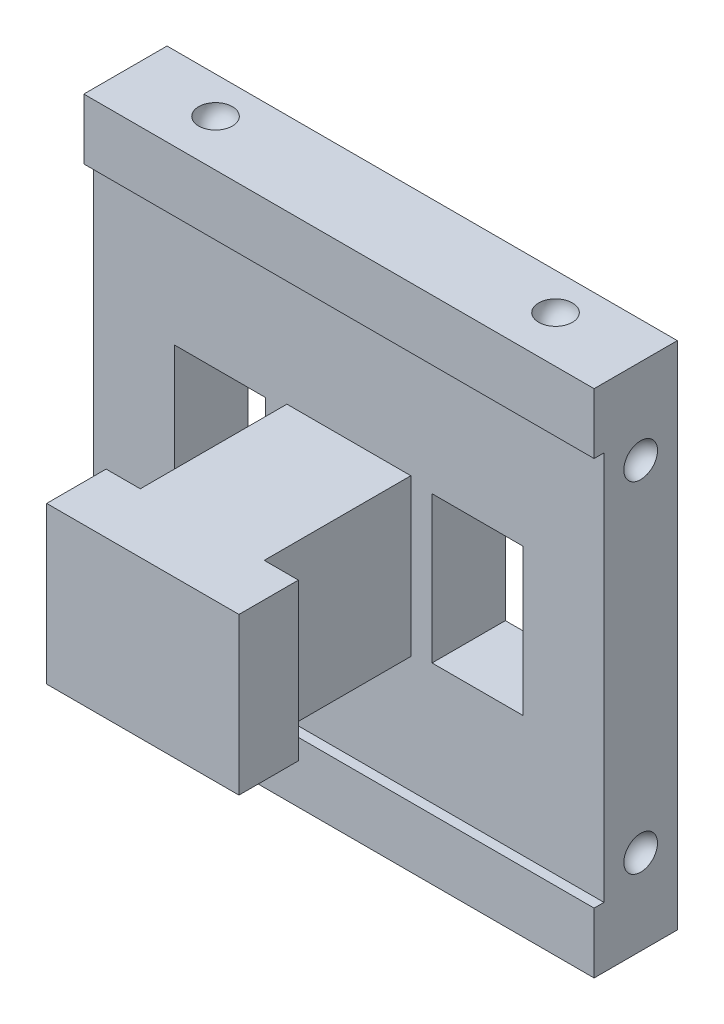
from build123d import *

# Parameters (mm, degrees)
EXTRUDE_1_DEPTH     = 3.7
CUT_EXTRUDE_1_REACH = 37.162
SKETCH_2_W          = 4.6
SKETCH_2_H          = 7.4
SKETCH_3_W          = 25.755
SKETCH_3_H          = 2
EXTRUDE_2_DEPTH     = 1
SKETCH_4_W          = 6.255
SKETCH_4_H          = 7.9
SKETCH_4_W_2        = 2.95
EXTRUDE_3_DEPTH     = 10.4
SKETCH_5_W          = 1.725
SKETCH_5_H          = 7.9
EXTRUDE_4_DEPTH     = 3
CUT_EXTRUDE_START   = -7.9
SKETCH_9_W          = 2.95
SKETCH_9_H          = 9.4
CUT_EXTRUDE_4_DEPTH = 7.9
FILLET_2_R          = 0.4
CUT_EXTRUDE_5_DEPTH = 7.9
CUT_EXTRUDE_START_2 = -25.755
SKETCH_12_W         = 1
SKETCH_12_H         = 2
CUT_EXTRUDE_6_DEPTH = 25.755
EXTRUDE_START       = -3.7
SKETCH_13_W         = 25.755
SKETCH_13_H         = 1.055
EXTRUDE_6_DEPTH     = 3.7
CUT_REVOLVE_1_ANGLE = 180
SKETCH_16_W         = 25.755
SKETCH_16_H         = 3.055
EXTRUDE_7_DEPTH     = 0.5


with BuildPart() as part:
    # ｽｹｯﾁ1 → ﾎﾞｽ - 押し出し1 (new body)
    with BuildSketch(Plane.XY):
        Polygon((0, 0), (12.75, 0), (25.755, 0), (25.755, 23.65), (12.75, 23.65), (0, 23.65), align=None)
    extrude(amount=EXTRUDE_1_DEPTH)

    # ｽｹｯﾁ2 → ｶｯﾄ - 押し出し1 (cut, up to next)
    with BuildSketch(Plane.XY.offset(3.7), mode=Mode.PRIVATE) as cut_extrude_1_sk1:
        with Locations((6.38, 11.825)):
            Rectangle(SKETCH_2_W, SKETCH_2_H)
    cut_extrude_1_tool1 = extrude(cut_extrude_1_sk1.sketch, amount=-CUT_EXTRUDE_1_REACH, mode=Mode.PRIVATE) & part.part
    # ｽｹｯﾁ2 → ｶｯﾄ - 押し出し1 (cut, up to next)
    with BuildSketch(Plane.XY.offset(3.7), mode=Mode.PRIVATE) as cut_extrude_1_sk2:
        with Locations((19.375, 11.825)):
            Rectangle(SKETCH_2_W, SKETCH_2_H)
    cut_extrude_1_tool2 = extrude(cut_extrude_1_sk2.sketch, amount=-CUT_EXTRUDE_1_REACH, mode=Mode.PRIVATE) & part.part
    add(cut_extrude_1_tool1.solids().sort_by_distance((6.38, 11.825, 3.7))[0], mode=Mode.SUBTRACT)
    add(cut_extrude_1_tool2.solids().sort_by_distance((19.375, 11.825, 3.7))[0], mode=Mode.SUBTRACT)

    # ｽｹｯﾁ3 → ﾎﾞｽ - 押し出し2 (add)
    with BuildSketch(Plane.XY.offset(3.7)):
        with Locations((12.8775, 22.65)):
            Rectangle(SKETCH_3_W, SKETCH_3_H)
        with Locations((12.8775, 1)):
            Rectangle(SKETCH_3_W, SKETCH_3_H)
    extrude(amount=EXTRUDE_2_DEPTH)

    # ｽｹｯﾁ4 → ﾎﾞｽ - 押し出し3 (add)
    with BuildSketch(Plane.XY.offset(3.7)):
        with Locations((12.8775, 11.825)):
            Rectangle(SKETCH_4_W, SKETCH_4_H)
        with Locations((1.475, 11.825)):
            Rectangle(SKETCH_4_W_2, SKETCH_4_H)
        with Locations((24.28, 11.825)):
            Rectangle(SKETCH_4_W_2, SKETCH_4_H)
    extrude(amount=EXTRUDE_3_DEPTH)

    # ｽｹｯﾁ5 → ﾎﾞｽ - 押し出し4 (add)
    with BuildSketch(Plane.XY.offset(14.1)):
        with Locations((16.8675, 11.825)):
            Rectangle(SKETCH_5_W, SKETCH_5_H)
        with Locations((8.8875, 11.825)):
            Rectangle(SKETCH_5_W, SKETCH_5_H)
    extrude(amount=-EXTRUDE_4_DEPTH)

    # ｽｹｯﾁ9 → ｶｯﾄ - 押し出し4 (cut)
    with BuildSketch(Plane.XZ.offset(-7.875).offset(CUT_EXTRUDE_START)):
        with Locations((1.475, 9.4)):
            Rectangle(SKETCH_9_W, SKETCH_9_H)
        with Locations((24.28, 9.4)):
            Rectangle(SKETCH_9_W, SKETCH_9_H)
    extrude(amount=CUT_EXTRUDE_4_DEPTH, mode=Mode.SUBTRACT)

    # ﾌｨﾚｯﾄ2
    fillet_2_edges = [part.edges().sort_by_distance(p)[0] for p in [
        (2.95, 11.825, 4.7),
        (22.805, 11.825, 4.7),
    ]]
    fillet(fillet_2_edges, radius=FILLET_2_R)

    # ｽｹｯﾁ11 → ｶｯﾄ - 押し出し5 (cut)
    with BuildSketch(Plane.XZ.offset(-7.875).offset(CUT_EXTRUDE_START)):
        with BuildLine():
            Line((2.95, 3.7), (2.95, 4.3))
            ThreePointArc((2.95, 4.3), (2.832842712, 4.582842712), (2.55, 4.7))
            Line((2.55, 4.7), (0, 4.7))
            Line((0, 4.7), (0, 3.7))
            Line((0, 3.7), (2.95, 3.7))
        make_face()
        with BuildLine():
            Line((25.755, 4.7), (23.205, 4.7))
            ThreePointArc((23.205, 4.7), (22.922157288, 4.582842712), (22.805, 4.3))
            Line((22.805, 4.3), (22.805, 3.7))
            Line((22.805, 3.7), (25.755, 3.7))
            Line((25.755, 3.7), (25.755, 4.7))
        make_face()
    extrude(amount=CUT_EXTRUDE_5_DEPTH, mode=Mode.SUBTRACT)

    # ｽｹｯﾁ12 → ｶｯﾄ - 押し出し6 (cut)
    with BuildSketch(Plane.ZY.offset(CUT_EXTRUDE_START_2)):
        with Locations((4.2, 22.65)):
            Rectangle(SKETCH_12_W, SKETCH_12_H)
        with Locations((4.2, 1)):
            Rectangle(SKETCH_12_W, SKETCH_12_H)
    extrude(amount=CUT_EXTRUDE_6_DEPTH, mode=Mode.SUBTRACT)

    # ｽｹｯﾁ13 → ﾎﾞｽ - 押し出し6 (add)
    with BuildSketch(Plane(origin=(0, 0, 0), x_dir=(-1, 0, 0), z_dir=(0, 0, -1)).offset(EXTRUDE_START)):
        with Locations((-12.8775, 24.1775)):
            Rectangle(SKETCH_13_W, SKETCH_13_H)
        with Locations((-12.8775, -0.5275)):
            Rectangle(SKETCH_13_W, SKETCH_13_H)
    extrude(amount=EXTRUDE_6_DEPTH)

    # ｽｹｯﾁ14 → ｶｯﾄ - 回転1 (revolve, cut)
    with BuildSketch(Plane(origin=(25.755, 0, 0), x_dir=(0, 0, -1), z_dir=(1, 0, 0))):
        with BuildLine():
            Line((-1.85, 21.255), (-1.85, 19.555))
            ThreePointArc((-1.85, 19.555), (-2.7, 20.405), (-1.85, 21.255))
        make_face()
        with BuildLine():
            Line((-1.85, 2.395), (-1.85, 4.095))
            ThreePointArc((-1.85, 4.095), (-2.7, 3.245), (-1.85, 2.395))
        make_face()
    cut_revolve_1 = revolve(axis=Axis((25.755, 21.255, 1.85), (0, -1, 0)), revolution_arc=CUT_REVOLVE_1_ANGLE, mode=Mode.SUBTRACT)

    # ﾐﾗｰ1: ｶｯﾄ - 回転1 across plane
    add(cut_revolve_1.mirror(Plane(origin=(12.8775, 0, 0), x_dir=(0, 0, 1), z_dir=(1, 0, 0))), mode=Mode.SUBTRACT)

    # ｽｹｯﾁ15 → ｶｯﾄ - 回転2 (revolve, cut)
    with BuildSketch(Plane(origin=(0, 24.705, 0), x_dir=(1, 0, 0), z_dir=(0, 1, 0))):
        with BuildLine():
            Line((3.4475, -1.85), (5.1475, -1.85))
            ThreePointArc((5.1475, -1.85), (4.2975, -2.7), (3.4475, -1.85))
        make_face()
        with BuildLine():
            Line((22.3075, -1.85), (20.6075, -1.85))
            ThreePointArc((20.6075, -1.85), (21.4575, -2.7), (22.3075, -1.85))
        make_face()
    cut_revolve_2 = revolve(axis=Axis((3.4475, 24.705, 1.85), (1, 0, 0)), mode=Mode.SUBTRACT)

    # ﾐﾗｰ2: ｶｯﾄ - 回転2 across plane
    add(cut_revolve_2.mirror(Plane(origin=(0, 11.825, 0), x_dir=(0, 0, 1), z_dir=(0, -1, 0))), mode=Mode.SUBTRACT)

    # ｽｹｯﾁ16 → ﾎﾞｽ - 押し出し7 (add)
    with BuildSketch(Plane.XY.offset(3.7)):
        with Locations((12.8775, 23.1775)):
            Rectangle(SKETCH_16_W, SKETCH_16_H)
        with Locations((12.8775, 0.4725)):
            Rectangle(SKETCH_16_W, SKETCH_16_H)
    extrude(amount=EXTRUDE_7_DEPTH)


solid = part.part
